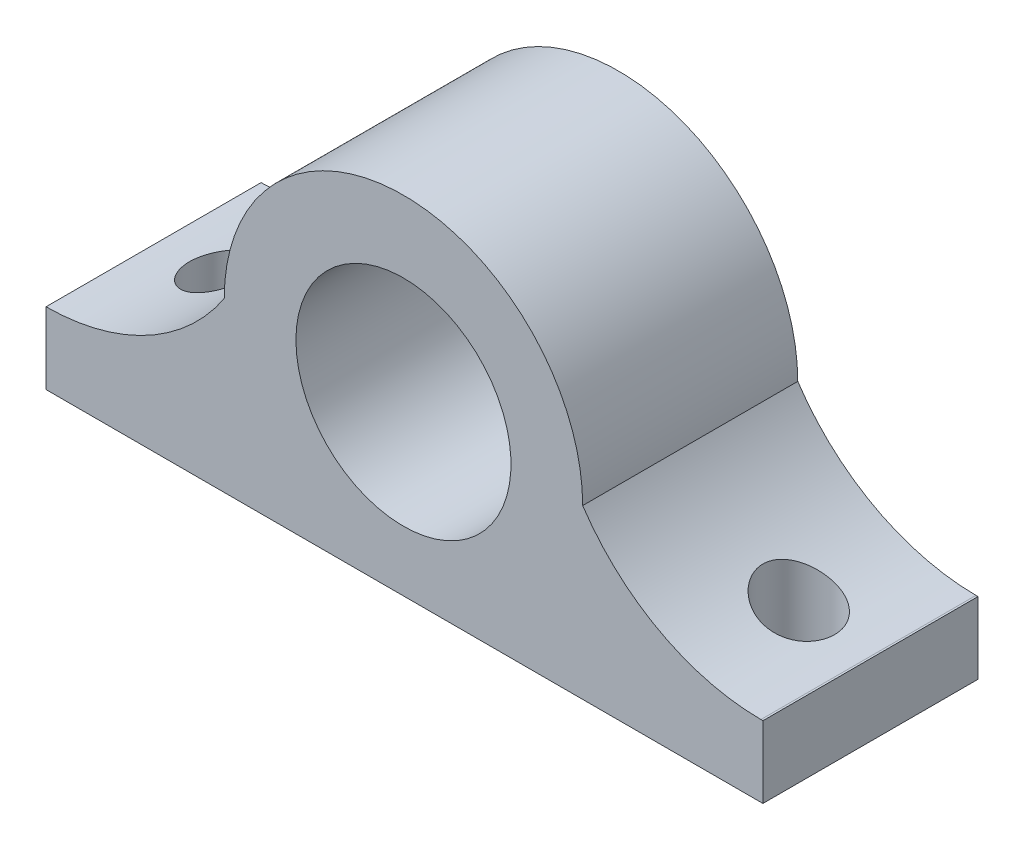
from build123d import *

# Parameters (mm, degrees)
SKETCH1_W           = 10
SKETCH1_H           = 3
BOSS_EXTRUDE1_DEPTH = 0.5
BOSS_EXTRUDE2_DEPTH = 3
CUT_EXTRUDE1_REACH  = 9.27
SKETCH4_R           = 1.5
CUT_EXTRUDE2_REACH  = 9.12
SKETCH5_R           = 0.5


with BuildPart() as part:
    # Sketch1 → Boss-Extrude1 (new, symmetric)
    with BuildSketch(Plane(origin=(0, 0, 0), x_dir=(1, 0, 0), z_dir=(0, 1, 0))):
        Rectangle(SKETCH1_W, SKETCH1_H)
    extrude(amount=BOSS_EXTRUDE1_DEPTH, both=True)

    # Sketch3 → Boss-Extrude2 (add)
    with BuildSketch(Plane(origin=(0, 0, -1.5), x_dir=(-1, 0, 0), z_dir=(0, 0, -1))):
        with BuildLine():
            Line((-5, 0.5), (-5, 0))
            Line((-5, 0), (5, 0))
            Line((5, 0), (5, 0.5))
            ThreePointArc((5, 0.5), (3.589234213, 0.859934084), (2.514072517, 1.841687605))
            ThreePointArc((2.514072517, 1.841687605), (0.014072517, 4.341687605), (-2.485927483, 1.841687605))
            ThreePointArc((-2.485927483, 1.841687605), (-3.573488857, 0.853279454), (-5, 0.5))
        make_face()
    extrude(amount=-BOSS_EXTRUDE2_DEPTH)

    # Sketch4 → Cut-Extrude1 (cut, up to next)
    with BuildSketch(Plane(origin=(0, 0, -1.5), x_dir=(-1, 0, 0), z_dir=(0, 0, -1)), mode=Mode.PRIVATE) as cut_extrude1_sk1:
        with Locations((0.014072517, 1.841687605)):
            Circle(SKETCH4_R)
    cut_extrude1_tool1 = extrude(cut_extrude1_sk1.sketch, amount=-CUT_EXTRUDE1_REACH, mode=Mode.PRIVATE) & part.part
    add(cut_extrude1_tool1.solids().sort_by_distance((-0.014073, 1.841688, -1.5))[0], mode=Mode.SUBTRACT)

    # Sketch5 → Cut-Extrude2 (cut, up to next)
    with BuildSketch(Plane.XZ.offset(0.5), mode=Mode.PRIVATE) as cut_extrude2_sk1:
        with Locations(Location((-4, 0, 0), (0, 0, 270))):
            Circle(SKETCH5_R)
    cut_extrude2_tool1 = extrude(cut_extrude2_sk1.sketch, amount=-CUT_EXTRUDE2_REACH, mode=Mode.PRIVATE) & part.part
    # Sketch5 → Cut-Extrude2 (cut, up to next)
    with BuildSketch(Plane.XZ.offset(0.5), mode=Mode.PRIVATE) as cut_extrude2_sk2:
        with Locations(Location((4, 0, 0), (0, 0, 270))):
            Circle(SKETCH5_R)
    cut_extrude2_tool2 = extrude(cut_extrude2_sk2.sketch, amount=-CUT_EXTRUDE2_REACH, mode=Mode.PRIVATE) & part.part
    add(cut_extrude2_tool1.solids().sort_by_distance((-4, -0.5, 0))[0], mode=Mode.SUBTRACT)
    add(cut_extrude2_tool2.solids().sort_by_distance((4, -0.5, 0))[0], mode=Mode.SUBTRACT)


solid = part.part
